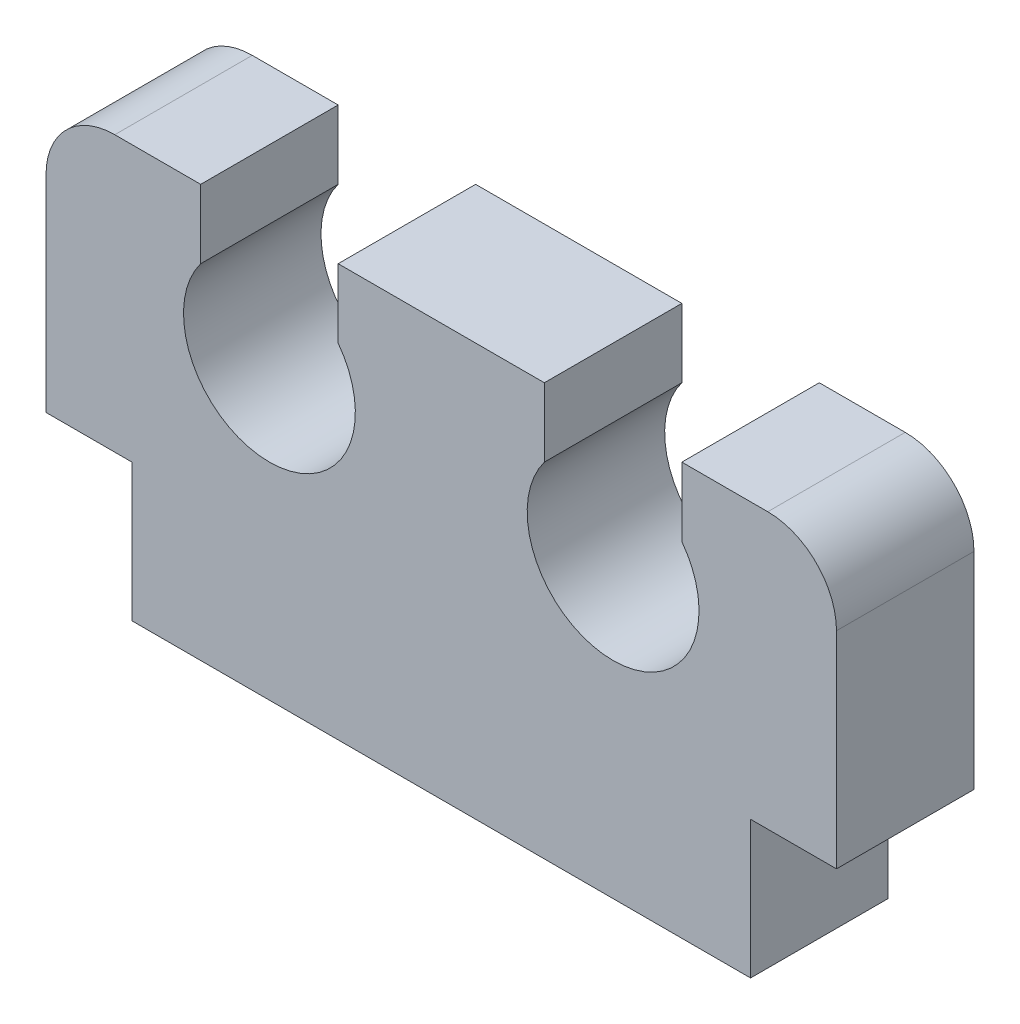
from build123d import *

# Parameters (mm, degrees)
BOSS_EXTRUDE1_DEPTH = 2


with BuildPart() as part:
    # Model → Boss-Extrude1 (new body)
    with BuildSketch(Plane.XY):
        with BuildLine():
            Line((1971.609841287, 1160.893641222), (1971.609841287, 1159.893641222))
            ThreePointArc((1971.609841287, 1159.893641222), (1972.609841287, 1157.893641222), (1973.609841287, 1159.893641222))
            Line((1973.609841287, 1159.893641222), (1973.609841287, 1160.893641222))
            Line((1973.609841287, 1160.893641222), (1976.609841287, 1160.893641222))
            Line((1976.609841287, 1160.893641222), (1976.609841287, 1159.893641222))
            ThreePointArc((1976.609841287, 1159.893641222), (1977.609841287, 1157.893641222), (1978.609841287, 1159.893641222))
            Line((1978.609841287, 1159.893641222), (1978.609841287, 1160.893641222))
            Line((1978.609841287, 1160.893641222), (1979.859841287, 1160.893641222))
            ThreePointArc((1979.859841287, 1160.893641222), (1980.566948068, 1160.600748003), (1980.859841287, 1159.893641222))
            Line((1980.859841287, 1159.893641222), (1980.859841287, 1156.893641222))
            Line((1980.859841287, 1156.893641222), (1979.609841287, 1156.893641222))
            Line((1979.609841287, 1156.893641222), (1979.609841287, 1154.893641222))
            Line((1979.609841287, 1154.893641222), (1970.609841287, 1154.893641222))
            Line((1970.609841287, 1154.893641222), (1970.609841287, 1156.893641222))
            Line((1970.609841287, 1156.893641222), (1969.359841287, 1156.893641222))
            Line((1969.359841287, 1156.893641222), (1969.359841287, 1159.893641222))
            ThreePointArc((1969.359841287, 1159.893641222), (1969.652734505, 1160.600748003), (1970.359841287, 1160.893641222))
            Line((1970.359841287, 1160.893641222), (1971.609841287, 1160.893641222))
        make_face()
    extrude(amount=BOSS_EXTRUDE1_DEPTH)


solid = part.part
